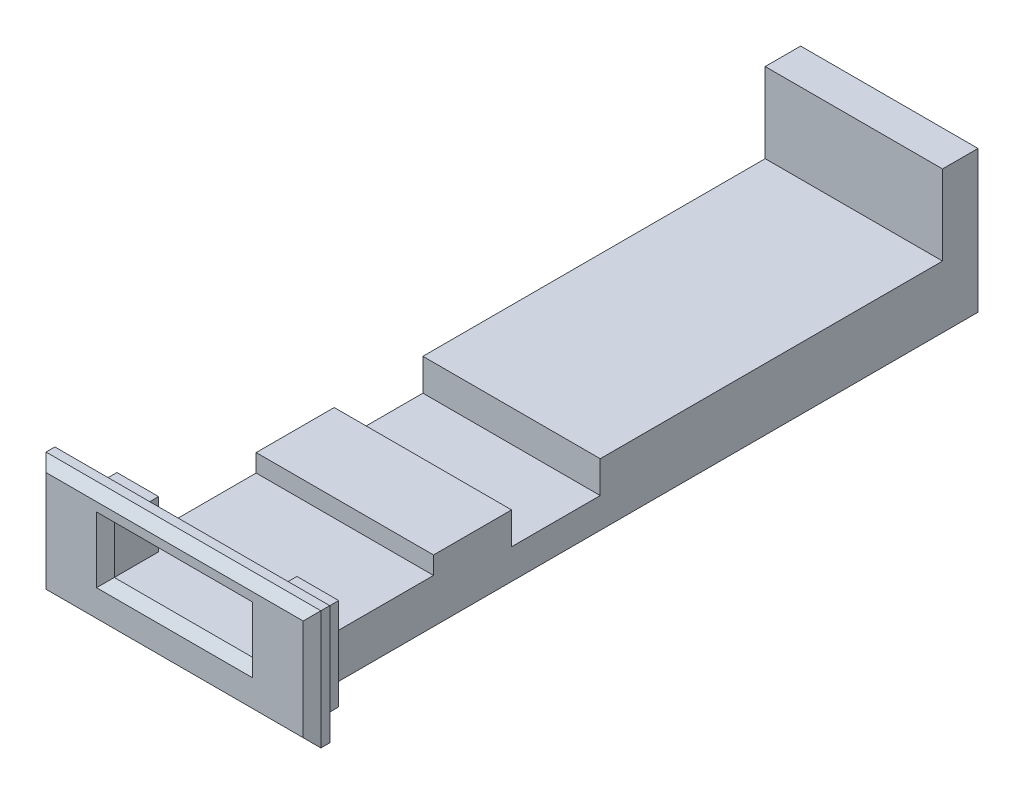
from build123d import *

# Parameters (mm, degrees)
BOSS_EXTRUDE1_DEPTH     = 7.75
CUT_EXTRUDE_THIN1_DEPTH = 42.810913647
CUT_EXTRUDE1_REACH      = 43.811
SKETCH3_W               = 7.8
SKETCH3_H               = 2.7
CHAMFER1_SIZE           = 0.5


with BuildPart() as part:
    # Sketch1 → Boss-Extrude1 (new, symmetric)
    with BuildSketch(Plane(origin=(0, 0, 0), x_dir=(0, 0, -1), z_dir=(1, 0, 0))):
        Polygon((0, 0), (40.3, 0), (40.3, 8), (38.3, 8), (38.3, 3.5), (19, 3.5), (19, 1.7), (14, 1.7), (14, 3.5), (9.6, 3.5), (9.6, 2.5), (3, 2.5), (3, 5.2), (1, 5.2), (1, 6.7), (0, 6.7), align=None)
    extrude(amount=BOSS_EXTRUDE1_DEPTH, both=True)

    # Sketch2 → Cut-Extrude-Thin1 (cut, through all)
    with BuildSketch(Plane(origin=(0, 0, 0), x_dir=(1, 0, 0), z_dir=(0, 1, 0))):
        Polygon((-17.75, -10), (17.75, -10), (17.75, 11), (16.25, 11), (16.25, 13), (15, 13), (15, 50.3), (-15, 50.3), (-15, 13), (-16.25, 13), (-16.25, 11), (-17.75, 11), align=None)
        Polygon((-7.75, 0), (7.75, 0), (7.75, 1), (6.25, 1), (6.25, 3), (5, 3), (5, 40.3), (-5, 40.3), (-5, 3), (-6.25, 3), (-6.25, 1), (-7.75, 1), align=None, mode=Mode.SUBTRACT)
    extrude(amount=CUT_EXTRUDE_THIN1_DEPTH, mode=Mode.SUBTRACT)

    # Sketch3 → Cut-Extrude1 (cut, up to next)
    with BuildSketch(Plane.XY, mode=Mode.PRIVATE) as cut_extrude1_sk1:
        with Locations((0, 3.85)):
            Rectangle(SKETCH3_W, SKETCH3_H)
    cut_extrude1_tool1 = extrude(cut_extrude1_sk1.sketch, amount=-CUT_EXTRUDE1_REACH, mode=Mode.PRIVATE) & part.part
    add(cut_extrude1_tool1.solids().sort_by_distance((0, 3.85, 0))[0], mode=Mode.SUBTRACT)

    # Chamfer1
    chamfer1_edges = [part.edges().sort_by_distance(p)[0] for p in [
        (-3.9, 3.85, 0),
        (0, 2.5, 0),
        (3.9, 3.85, 0),
        (0, 5.2, 0),
        (-7.75, 3.35, 0),
        (0, 6.7, 0),
        (0, 0, 0),
        (7.75, 3.35, 0),
    ]]
    chamfer(chamfer1_edges, length=CHAMFER1_SIZE)


solid = part.part
